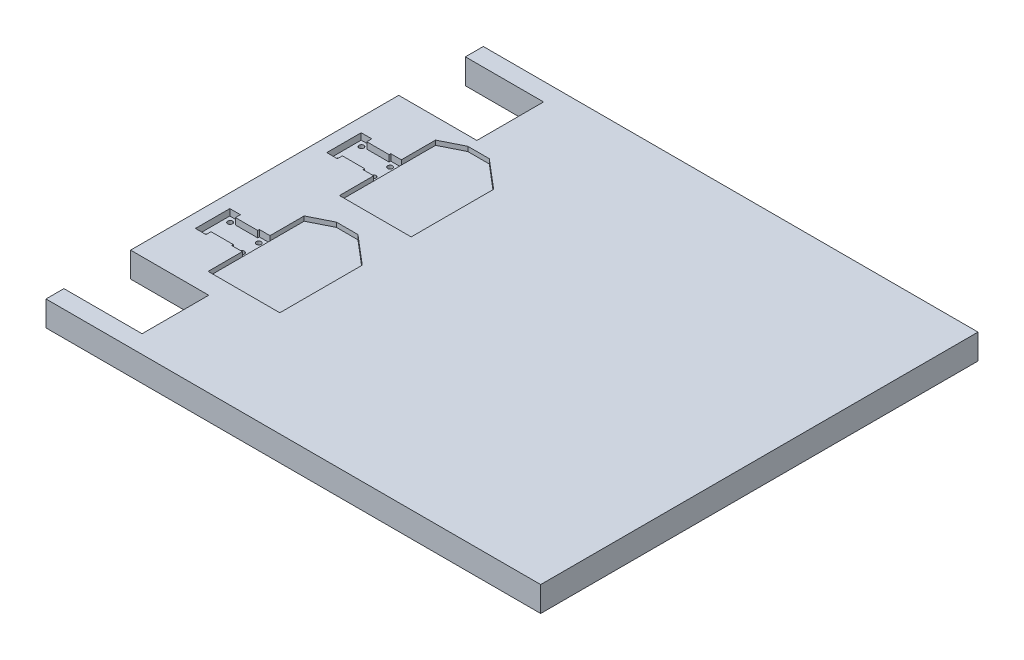
from build123d import *

# Parameters (mm, degrees)
BOSS_EXTRUDE1_DEPTH                             = 17.5
SKETCH2_R                                       = 1.5
CUT_EXTRUDE1_DEPTH                              = 4.5
CSK_FOR_M3_OVAL_HEAD_MACHINE_SCREW1_D           = 3.4
CSK_FOR_M3_OVAL_HEAD_MACHINE_SCREW1_CSINK_D     = 6.3
CSK_FOR_M3_OVAL_HEAD_MACHINE_SCREW1_CSINK_ANGLE = 90
CUT_EXTRUDE2_DEPTH                              = 3.2


with BuildPart() as part:
    # Sketch1 → Boss-Extrude1 (new body)
    with BuildSketch(Plane(origin=(0, 0, 0), x_dir=(1, 0, 0), z_dir=(0, 1, 0))):
        Polygon((27.724299065, -2.579662371), (27.724299065, 43.920337629), (-26.775700935, 43.920337629), (-26.775700935, 230.920337629), (27.724299065, 230.920337629), (27.724299065, 277.420337629), (-26.775700935, 277.420337629), (-26.775700935, 289.920337629), (318.224299065, 289.920337629), (318.224299065, -15.079662371), (-26.775700935, -15.079662371), (-26.775700935, -2.579662371), align=None)
    extrude(amount=BOSS_EXTRUDE1_DEPTH)

    # Sketch2 → Cut-Extrude1 (cut)
    # profile 1 of 2: a face of its own
    with BuildSketch(Plane(origin=(0, 17.5, 0), x_dir=(1, 0, 0), z_dir=(0, 1, 0))):
        Polygon((5.694299065, 191.745337629), (-9.875700935, 191.745337629), (-9.875700935, 195.230337629), (-17.275700935, 195.230337629), (-17.275700935, 171.230337629), (-9.875700935, 171.230337629), (-9.875700935, 174.715337629), (5.694299065, 174.715337629), (5.694299065, 173.570337629), (13.094299065, 173.570337629), (13.094299065, 192.890337629), (5.694299065, 192.890337629), align=None)
        with Locations(Location((-13.275700935, 191.420337629, 0), (0, 0, 270))):
            Circle(SKETCH2_R, mode=Mode.SUBTRACT)
        with Locations(Location((-13.275700935, 175.040337629, 0), (0, 0, 270))):
            Circle(SKETCH2_R, mode=Mode.SUBTRACT)
        with Locations(Location((9.094299065, 189.050337629, 0), (0, 0, 270))):
            Circle(SKETCH2_R, mode=Mode.SUBTRACT)
        with Locations(Location((9.094299065, 177.410337629, 0), (0, 0, 270))):
            Circle(SKETCH2_R, mode=Mode.SUBTRACT)
    # profile 2 of 2: a face of its own
    with BuildSketch(Plane(origin=(0, 17.5, 0), x_dir=(1, 0, 0), z_dir=(0, 1, 0))):
        Polygon((5.694299065, 100.125337629), (-9.875700935, 100.125337629), (-9.875700935, 103.610337629), (-17.275700935, 103.610337629), (-17.275700935, 79.610337629), (-9.875700935, 79.610337629), (-9.875700935, 83.095337629), (5.694299065, 83.095337629), (5.694299065, 81.950337629), (13.094299065, 81.950337629), (13.094299065, 101.270337629), (5.694299065, 101.270337629), align=None)
        with Locations(Location((-13.275700935, 99.800337629, 0), (0, 0, 270))):
            Circle(SKETCH2_R, mode=Mode.SUBTRACT)
        with Locations(Location((-13.275700935, 83.420337629, 0), (0, 0, 270))):
            Circle(SKETCH2_R, mode=Mode.SUBTRACT)
        with Locations(Location((9.094299065, 97.430337629, 0), (0, 0, 270))):
            Circle(SKETCH2_R, mode=Mode.SUBTRACT)
        with Locations(Location((9.094299065, 85.790337629, 0), (0, 0, 270))):
            Circle(SKETCH2_R, mode=Mode.SUBTRACT)
    extrude(amount=-CUT_EXTRUDE1_DEPTH, mode=Mode.SUBTRACT)

    # CSK for M3 Oval Head Machine Screw1 (through all)
    with Locations(Plane(origin=(0, 0, 0), x_dir=(-1, 0, 0), z_dir=(0, -1, 0))):
        with Locations((13.275700935, 191.420337629), (13.275700935, 175.040337629), (-9.094299065, 177.410337629), (-9.094299065, 189.050337629), (13.275700935, 83.420337629), (13.275700935, 99.800337629), (-9.094299065, 97.430337629), (-9.094299065, 85.790337629)):
            CounterSinkHole(CSK_FOR_M3_OVAL_HEAD_MACHINE_SCREW1_D / 2, CSK_FOR_M3_OVAL_HEAD_MACHINE_SCREW1_CSINK_D / 2, counter_sink_angle=CSK_FOR_M3_OVAL_HEAD_MACHINE_SCREW1_CSINK_ANGLE)

    # Sketch7 → Cut-Extrude2 (cut)
    with BuildSketch(Plane(origin=(0, 17.5, 0), x_dir=(1, 0, 0), z_dir=(0, 1, 0))):
        Polygon((13.094299065, 183.230337629), (13.094299065, 216.730337629), (28.094299065, 224.230337629), (43.094299065, 224.230337629), (63.094299065, 207.230337629), (63.094299065, 149.730337629), (13.094299065, 149.730337629), align=None)
        Polygon((13.094299065, 91.610337629), (13.094299065, 125.110337629), (28.094299065, 132.610337629), (43.094299065, 132.610337629), (63.094299065, 115.610337629), (63.094299065, 58.110337629), (13.094299065, 58.110337629), align=None)
    extrude(amount=-CUT_EXTRUDE2_DEPTH, mode=Mode.SUBTRACT)


solid = part.part
